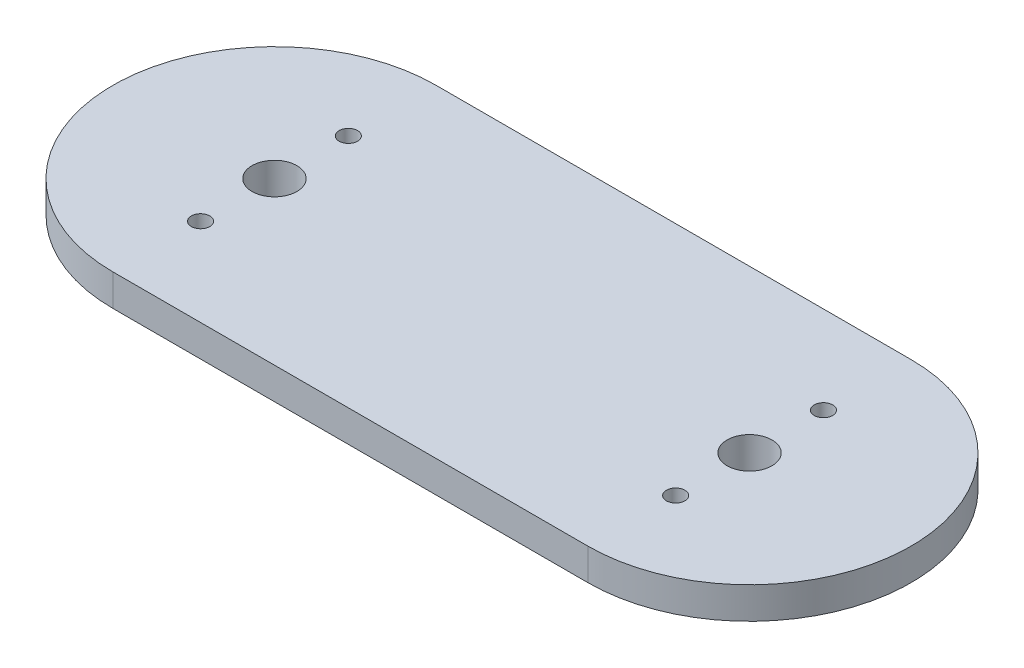
from build123d import *

# Parameters (mm, degrees)
BOSS_EXTRUDE1_DEPTH = 3
SKETCH2_R           = 2.125
SKETCH2_R_2         = 0.875
CUT_EXTRUDE1_DEPTH  = 57.401986652


with BuildPart() as part:
    # Sketch1 → Boss-Extrude1 (new body)
    with BuildSketch(Plane(origin=(0, 0, 0), x_dir=(1, 0, 0), z_dir=(0, 1, 0))):
        with BuildLine():
            Line((-31.972318339, 0), (13.027681661, 0))
            ThreePointArc((13.027681661, 0), (28.332991201, -15.30530954), (13.027681661, -30.61061908))
            Line((13.027681661, -30.61061908), (-31.972318339, -30.61061908))
            ThreePointArc((-31.972318339, -30.61061908), (-47.277627879, -15.30530954), (-31.972318339, 0))
        make_face()
    extrude(amount=BOSS_EXTRUDE1_DEPTH)

    # Sketch2 → Cut-Extrude1 (cut, through all)
    with BuildSketch(Plane(origin=(0, 3, 0), x_dir=(1, 0, 0), z_dir=(0, 1, 0))):
        with Locations(Location((-31.972318339, -15.30530954, 0), (0, 0, 270))):
            Circle(SKETCH2_R)
        with Locations(Location((-31.972318339, -8.30530954, 0), (0, 0, 270))):
            Circle(SKETCH2_R_2)
        with Locations(Location((-31.972318339, -22.30530954, 0), (0, 0, 90))):
            Circle(SKETCH2_R_2)
        with Locations(Location((13.027681661, -8.30530954, 0), (0, 0, 90))):
            Circle(SKETCH2_R_2)
        with Locations(Location((13.027681661, -15.30530954, 0), (0, 0, 90))):
            Circle(SKETCH2_R)
        with Locations(Location((13.027681661, -22.30530954, 0), (0, 0, 270))):
            Circle(SKETCH2_R_2)
    extrude(amount=-CUT_EXTRUDE1_DEPTH, mode=Mode.SUBTRACT)


solid = part.part
